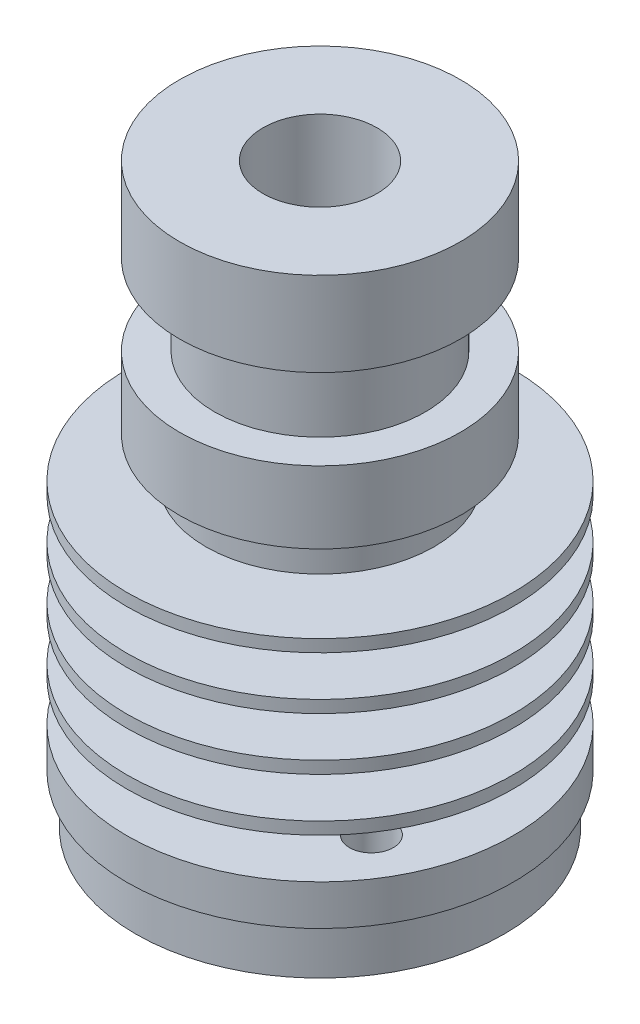
from build123d import *

# Parameters (mm, degrees)
SKETCH2_R                           = 10.5
BOSS_EXTRUDE1_DEPTH                 = 2.8
SKETCH4_W                           = 1.25
SKETCH4_H                           = 5.1
F_2_5_2_5_DIAMETER_HOLE1_AT_2_COUNT = 2
F_2_5_2_5_DIAMETER_HOLE1_AT_2_PITCH = 13.856406461
F_2_5_2_5_DIAMETER_HOLE1_AT_3_COUNT = 2
F_2_5_2_5_DIAMETER_HOLE1_AT_3_PITCH = 13.856406461
CHAMFER1_SIZE                       = 0.5


with BuildPart() as part:
    # Sketch1 → Revolve1 (revolve)
    with BuildSketch(Plane(origin=(0, 0, 0), x_dir=(-1, 0, 0), z_dir=(0, 0, -1)), mode=Mode.PRIVATE) as revolve1_sk:
        Polygon((-11, 2.8), (0, 2.8), (0, 32.9), (-8, 32.9), (-8, 28.1), (-6, 28.1), (-6, 23.5), (-8, 23.5), (-8, 19.4), (-6.5, 19.4), (-6.5, 17.1), (-11, 17.1), (-11, 16.4), (-6.5, 16.4), (-6.5, 14.1), (-11, 14.1), (-11, 13.4), (-6.5, 13.4), (-6.5, 11.1), (-11, 11.1), (-11, 10.4), (-6.5, 10.4), (-6.5, 8.1), (-11, 8.1), (-11, 7.4), (-6.5, 7.4), (-6.5, 5.1), (-11, 5.1), align=None)
    revolve(revolve1_sk.sketch.rotate(Axis((0, 2.8, 0), (0, 1, 0)), 270), axis=Axis((0, 2.8, 0), (0, 1, 0)))

    # Sketch2 → Boss-Extrude1 (add)
    with BuildSketch(Plane.XZ.offset(-2.8)):
        with Locations(Location((0, 0, 0), (0, 0, 270))):
            Circle(SKETCH2_R)
    extrude(amount=BOSS_EXTRUDE1_DEPTH)

    # Sketch3 → Cut-Revolve1 (revolve, cut)
    with BuildSketch(Plane(origin=(0, 0, 0), x_dir=(-1, 0, 0), z_dir=(0, 0, -1)), mode=Mode.PRIVATE) as cut_revolve1_sk:
        Polygon((-9.75, 0), (0, 0), (0, 32.9), (-3.25, 32.9), (-3.25, 11.5), (-4.75, 10), (-4.75, 4.55), (-5.5, 4.55), (-5.5, 1.55), (-9.75, 1.55), align=None)
    revolve(cut_revolve1_sk.sketch.rotate(Axis((0, 0, 0), (0, 1, 0)), 180), axis=Axis((0, 0, 0), (0, 1, 0)), mode=Mode.SUBTRACT)

    # Sketch4 → Ø2.5 (2.5) Diameter Hole1 (revolve, cut)
    with BuildSketch(Plane(origin=(-6.92820323, 5.1, 4), x_dir=(0, 0, 1), z_dir=(1, 0, 0))):
        with Locations((0.625, 2.55)):
            Rectangle(SKETCH4_W, SKETCH4_H)
    f_2_5_2_5_diameter_hole1 = revolve(axis=Axis((-6.92820323, 11.45, 4), (0, -1, 0)), mode=Mode.SUBTRACT)

    # Ø2.5 (2.5) Diameter Hole1 at 2: Ø2.5 (2.5) Diameter Hole1 ×2
    with Locations(*[Vector(0.5000000000000001, 0, -0.8660254037844387) * (i * F_2_5_2_5_DIAMETER_HOLE1_AT_2_PITCH) for i in range(1, F_2_5_2_5_DIAMETER_HOLE1_AT_2_COUNT)]):
        add(f_2_5_2_5_diameter_hole1, mode=Mode.SUBTRACT)

    # Ø2.5 (2.5) Diameter Hole1 at 3: Ø2.5 (2.5) Diameter Hole1 ×2
    with Locations(*[(i * F_2_5_2_5_DIAMETER_HOLE1_AT_3_PITCH, 0, 0) for i in range(1, F_2_5_2_5_DIAMETER_HOLE1_AT_3_COUNT)]):
        add(f_2_5_2_5_diameter_hole1, mode=Mode.SUBTRACT)

    # Chamfer1
    chamfer1_edges = [part.edges().sort_by_distance(p)[0] for p in [
        (4.75, 4.55, 0),
        (5.5, 1.55, 0),
    ]]
    chamfer(chamfer1_edges, length=CHAMFER1_SIZE)


solid = part.part
